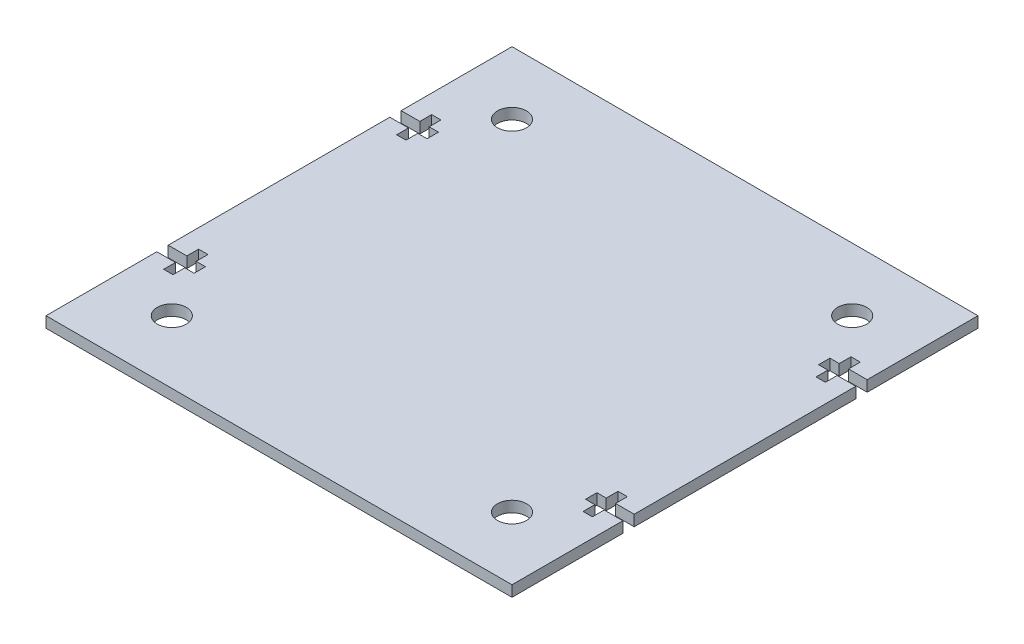
from build123d import *

# Parameters (mm, degrees)
BOSS_EXTRUDE1_DEPTH = 2.9718
SKETCH3_R           = 3.96875
CUT_EXTRUDE1_DEPTH  = 2.9718


with BuildPart() as part:
    # Sketch2 → Boss-Extrude1 (new body)
    with BuildSketch(Plane(origin=(0, 0, 0), x_dir=(1, 0, 0), z_dir=(0, 1, 0))):
        Polygon((0, 30.2006), (0, 0), (127, 0), (127, 30.2006), (121.92, 30.2006), (121.92, 26.9875), (119.38, 26.9875), (119.38, 30.2006), (116.84, 30.2006), (116.84, 33.2994), (119.38, 33.2994), (119.38, 36.5125), (121.92, 36.5125), (121.92, 33.2994), (127, 33.2994), (127, 63.5), (127, 93.7006), (121.92, 93.7006), (121.92, 90.4875), (119.38, 90.4875), (119.38, 93.7006), (116.84, 93.7006), (116.84, 96.7994), (119.38, 96.7994), (119.38, 100.0125), (121.92, 100.0125), (121.92, 96.7994), (127, 96.7994), (127, 127), (0, 127), (0, 96.7994), (5.08, 96.7994), (5.08, 100.0125), (7.62, 100.0125), (7.62, 96.7994), (10.16, 96.7994), (10.16, 93.7006), (7.62, 93.7006), (7.62, 90.4875), (5.08, 90.4875), (5.08, 93.7006), (0, 93.7006), (0, 63.5), (0, 33.2994), (5.08, 33.2994), (5.08, 36.5125), (7.62, 36.5125), (7.62, 33.2994), (10.16, 33.2994), (10.16, 30.2006), (7.62, 30.2006), (7.62, 26.9875), (5.08, 26.9875), (5.08, 30.2006), align=None)
    extrude(amount=BOSS_EXTRUDE1_DEPTH)

    # Sketch3 → Cut-Extrude1 (cut)
    with BuildSketch(Plane(origin=(0, 2.9718, 0), x_dir=(1, 0, 0), z_dir=(0, 1, 0))):
        with Locations(Location((17.145, 109.855, 0), (0, 0, 270))):
            Circle(SKETCH3_R)
        with Locations(Location((109.855, 109.855, 0), (0, 0, 270))):
            Circle(SKETCH3_R)
        with Locations(Location((109.855, 17.145, 0), (0, 0, 270))):
            Circle(SKETCH3_R)
        with Locations(Location((17.145, 17.145, 0), (0, 0, 270))):
            Circle(SKETCH3_R)
    extrude(amount=-CUT_EXTRUDE1_DEPTH, mode=Mode.SUBTRACT)


solid = part.part
